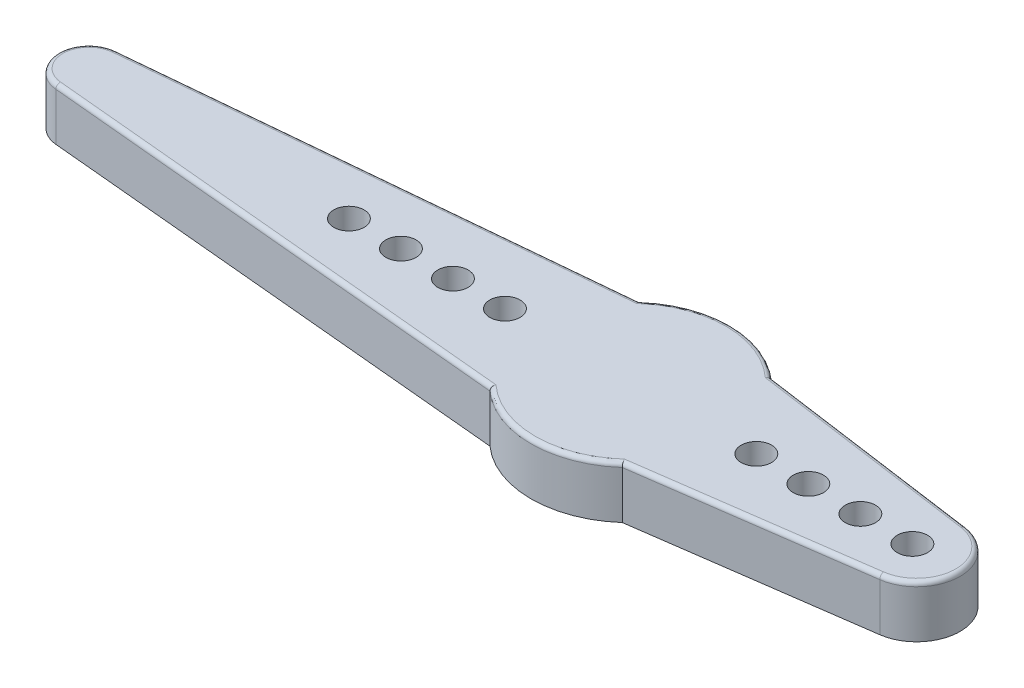
from build123d import *

# Parameters (mm, degrees)
SKETCH1_R           = 0.875
SKETCH1_R_2         = 3.5
BOSS_EXTRUDE1_DEPTH = 3
BOSS_EXTRUDE2_START = -2
SKETCH2_R           = 3.5
BOSS_EXTRUDE2_DEPTH = 2
FILLET1_R           = 0.25


with BuildPart() as part:
    # Sketch1 → Boss-Extrude1 (new body)
    with BuildSketch(Plane(origin=(0, 8.778505218, 0), x_dir=(1, 0, 0), z_dir=(0, 1, 0))):
        with BuildLine():
            Line((39.666515042, -34.709383283), (12.072408659, -37.266851361))
            ThreePointArc((12.072408659, -37.266851361), (10.483909442, -39.009383283), (12.072408659, -40.751915204))
            Line((12.072408659, -40.751915204), (39.666515042, -43.309383283))
            ThreePointArc((39.666515042, -43.309383283), (43.483909442, -44.759383283), (47.301303841, -43.309383283))
            Line((47.301303841, -43.309383283), (60.330539136, -41.485236238))
            ThreePointArc((60.330539136, -41.485236238), (62.483909442, -39.009383283), (60.330539136, -36.533530328))
            Line((60.330539136, -36.533530328), (47.301303841, -34.709383283))
            ThreePointArc((47.301303841, -34.709383283), (43.483909442, -33.259383283), (39.666515042, -34.709383283))
        make_face()
        with Locations(Location((27.233909442, -39.009383283, 0), (0, 0, 270))):
            Circle(SKETCH1_R, mode=Mode.SUBTRACT)
        with Locations(Location((30.233909442, -39.009383283, 0), (0, 0, 270))):
            Circle(SKETCH1_R, mode=Mode.SUBTRACT)
        with Locations(Location((33.233909442, -39.009383283, 0), (0, 0, 270))):
            Circle(SKETCH1_R, mode=Mode.SUBTRACT)
        with Locations(Location((36.233909442, -39.009383283, 0), (0, 0, 270))):
            Circle(SKETCH1_R, mode=Mode.SUBTRACT)
        with Locations(Location((43.483909442, -39.009383283, 0), (0, 0, 270))):
            Circle(SKETCH1_R_2, mode=Mode.SUBTRACT)
        with Locations(Location((50.733909442, -39.009383283, 0), (0, 0, 270))):
            Circle(SKETCH1_R, mode=Mode.SUBTRACT)
        with Locations(Location((53.733909442, -39.009383283, 0), (0, 0, 270))):
            Circle(SKETCH1_R, mode=Mode.SUBTRACT)
        with Locations(Location((56.733909442, -39.009383283, 0), (0, 0, 270))):
            Circle(SKETCH1_R, mode=Mode.SUBTRACT)
        with Locations(Location((59.733909442, -39.009383283, 0), (0, 0, 270))):
            Circle(SKETCH1_R, mode=Mode.SUBTRACT)
    extrude(amount=BOSS_EXTRUDE1_DEPTH)

    # Sketch2 → Boss-Extrude2 (add)
    with BuildSketch(Plane(origin=(0, 11.778505218, 0), x_dir=(1, 0, 0), z_dir=(0, 1, 0)).offset(BOSS_EXTRUDE2_START)):
        with Locations(Location((43.483909442, -39.009383283, 0), (0, 0, 270))):
            Circle(SKETCH2_R)
    extrude(amount=BOSS_EXTRUDE2_DEPTH)

    # Fillet1
    fillet1_edges = [part.edges().sort_by_distance(p)[0] for p in [
        (25.869461851, 11.778505218, 42.030649244),
        (43.483909442, 11.778505218, 44.759383283),
        (53.815921489, 11.778505218, 42.39730976),
        (62.483909442, 11.778505218, 39.009383283),
        (53.815921489, 11.778505218, 35.621456805),
        (43.483909442, 11.778505218, 33.259383283),
        (25.869461851, 11.778505218, 35.988117322),
        (10.483909442, 11.778505218, 39.009383283),
    ]]
    fillet(fillet1_edges, radius=FILLET1_R)


solid = part.part
